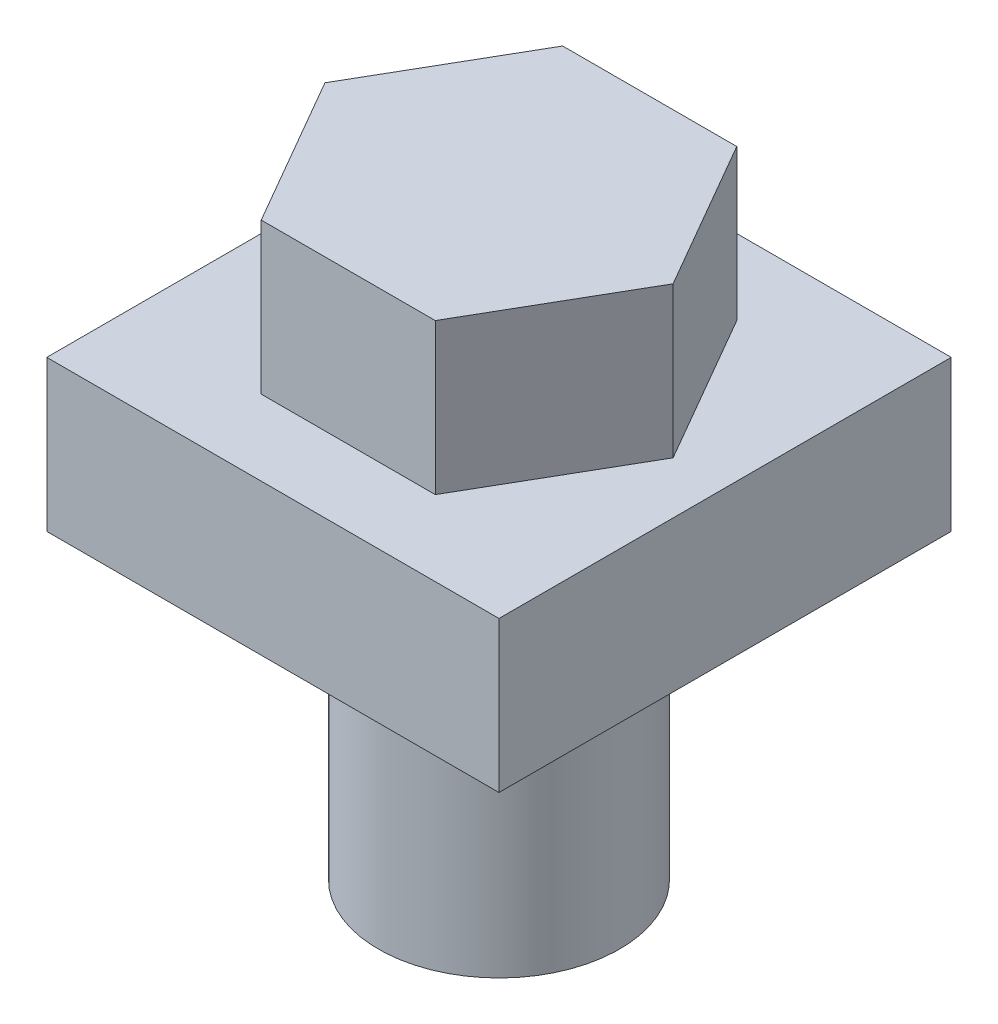
from build123d import *

# Parameters (mm, degrees)
SKETCH1_W           = 15
SKETCH1_H           = 15
BOSS_EXTRUDE1_DEPTH = 5
BOSS_EXTRUDE2_DEPTH = 5
SKETCH3_R           = 4
BOSS_EXTRUDE3_DEPTH = 10


with BuildPart() as part:
    # Sketch1 → Boss-Extrude1 (new body)
    with BuildSketch(Plane(origin=(0, 0, 0), x_dir=(1, 0, 0), z_dir=(0, 1, 0))):
        Rectangle(SKETCH1_W, SKETCH1_H)
    extrude(amount=BOSS_EXTRUDE1_DEPTH)

    # Sketch2 → Boss-Extrude2 (add)
    with BuildSketch(Plane(origin=(0, 5, 0), x_dir=(1, 0, 0), z_dir=(0, 1, 0))):
        Polygon((-2.886751346, 5), (-5.773502692, 0), (-2.886751346, -5), (2.886751346, -5), (5.773502692, 0), (2.886751346, 5), align=None)
    extrude(amount=BOSS_EXTRUDE2_DEPTH)

    # Sketch3 → Boss-Extrude3 (add)
    with BuildSketch(Plane.XZ):
        with Locations(Location((0, 0, 0), (0, 0, 270))):
            Circle(SKETCH3_R)
    extrude(amount=BOSS_EXTRUDE3_DEPTH)


solid = part.part
